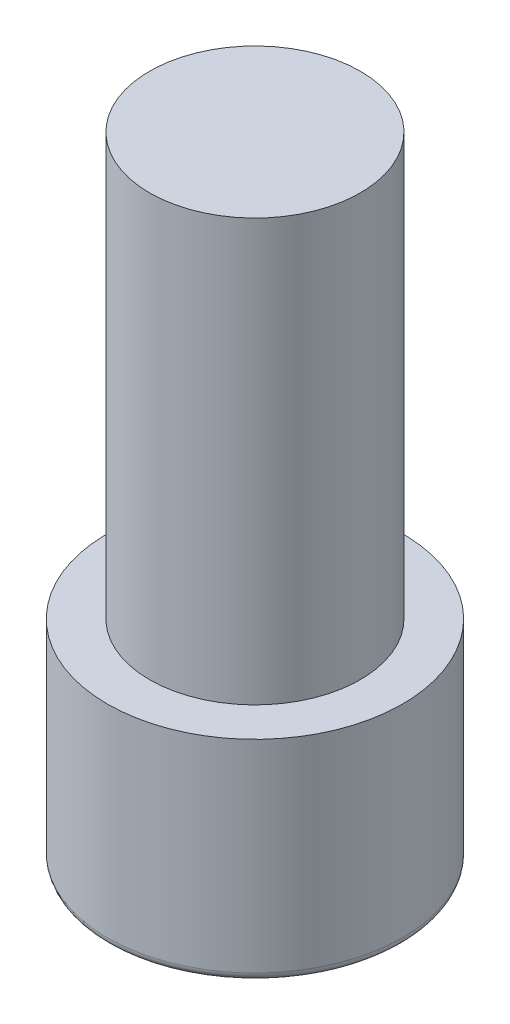
from build123d import *

# Parameters (mm, degrees)
SKETCH1_R           = 3.5
BOSS_EXTRUDE1_DEPTH = 5
SKETCH2_R           = 2.5
BOSS_EXTRUDE2_DEPTH = 10
CUT_EXTRUDE1_DEPTH  = 2
CHAMFER1_SIZE       = 0.25
FILLET1_R           = 0.2


with BuildPart() as part:
    # Sketch1 → Boss-Extrude1 (new body)
    with BuildSketch(Plane(origin=(0, 0, 0), x_dir=(1, 0, 0), z_dir=(0, 1, 0))):
        with Locations(Location((0, 0, 0), (0, 0, 270))):
            Circle(SKETCH1_R)
    extrude(amount=BOSS_EXTRUDE1_DEPTH)

    # Sketch2 → Boss-Extrude2 (add)
    with BuildSketch(Plane(origin=(0, 5, 0), x_dir=(1, 0, 0), z_dir=(0, 1, 0))):
        with Locations(Location((0, 0, 0), (0, 0, 270))):
            Circle(SKETCH2_R)
    extrude(amount=BOSS_EXTRUDE2_DEPTH)

    # Sketch3 → Cut-Extrude1 (cut)
    with BuildSketch(Plane.XZ):
        Polygon((0, 2), (-1.732050808, 1), (-1.732050808, -1), (0, -2), (1.732050808, -1), (1.732050808, 1), align=None)
    extrude(amount=-CUT_EXTRUDE1_DEPTH, mode=Mode.SUBTRACT)

    # Chamfer1
    chamfer1_edges = [part.edges().sort_by_distance(p)[0] for p in [
        (0.866025404, 0, 1.5),
        (-0.866025404, 0, 1.5),
        (-1.732050808, 0, 0),
        (-0.866025404, 0, -1.5),
        (0.866025404, 0, -1.5),
        (1.732050808, 0, 0),
    ]]
    chamfer(chamfer1_edges, length=CHAMFER1_SIZE)

    # Fillet1
    fillet1_edges = [part.edges().sort_by_distance(p)[0] for p in [
        (0, 0, -3.5),
    ]]
    fillet(fillet1_edges, radius=FILLET1_R)


solid = part.part
